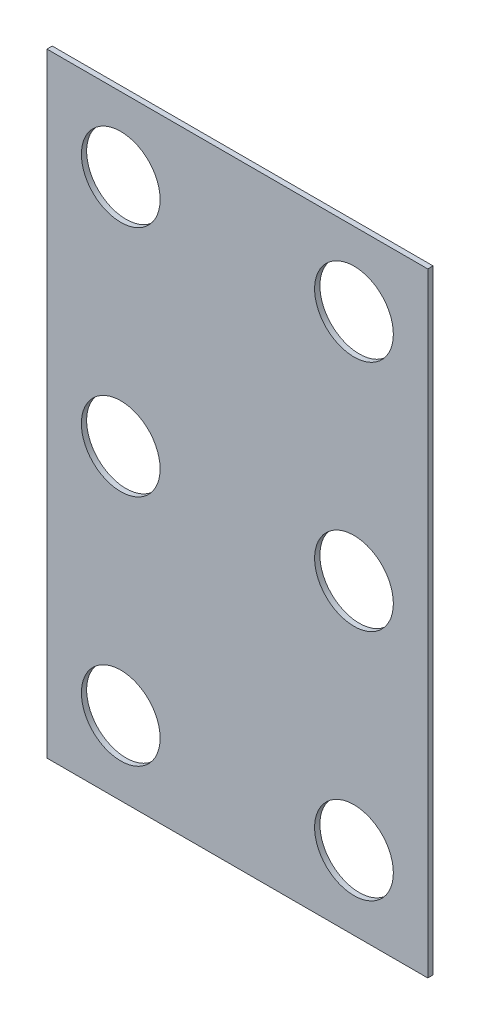
from build123d import *

# Parameters (mm, degrees)
SKETCH2_W           = 33.18
SKETCH2_H           = 53.5
SKETCH2_R           = 3.43
BOSS_EXTRUDE1_DEPTH = 0.46


with BuildPart() as part:
    # Sketch2 → Boss-Extrude1 (new body)
    with BuildSketch(Plane.XY):
        with Locations((16.59, 26.75)):
            Rectangle(SKETCH2_W, SKETCH2_H)
        with Locations((6.43, 47.07)):
            Circle(SKETCH2_R, mode=Mode.SUBTRACT)
        with Locations((26.75, 47.07)):
            Circle(SKETCH2_R, mode=Mode.SUBTRACT)
        with Locations((26.75, 26.75)):
            Circle(SKETCH2_R, mode=Mode.SUBTRACT)
        with Locations((26.75, 6.43)):
            Circle(SKETCH2_R, mode=Mode.SUBTRACT)
        with Locations((6.43, 26.75)):
            Circle(SKETCH2_R, mode=Mode.SUBTRACT)
        with Locations((6.43, 6.43)):
            Circle(SKETCH2_R, mode=Mode.SUBTRACT)
    extrude(amount=BOSS_EXTRUDE1_DEPTH)


solid = part.part
